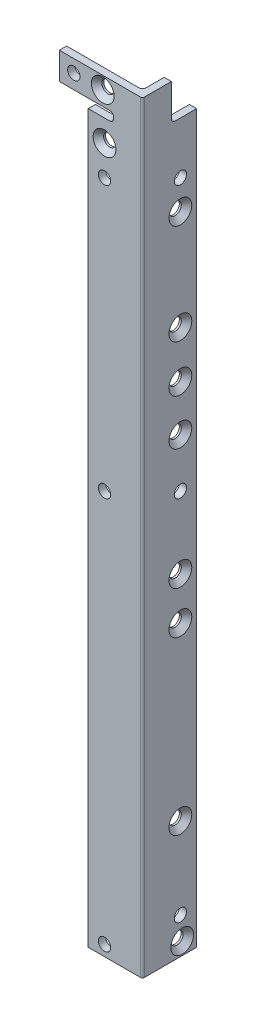
from build123d import *

# Parameters (mm, degrees)
BOSS_EXTRUDE1_DEPTH                             = 211
CSK_FOR_M3_FLAT_HEAD_MACHINE_SCREW1_D           = 3.4
CSK_FOR_M3_FLAT_HEAD_MACHINE_SCREW1_CSINK_D     = 6.3
CSK_FOR_M3_FLAT_HEAD_MACHINE_SCREW1_CSINK_ANGLE = 90
SKETCH5_W                                       = 7
SKETCH5_H                                       = 10
CUT_EXTRUDE1_DEPTH                              = 213.063669684
SKETCH6_W                                       = 7
SKETCH6_H                                       = 2.5
CUT_EXTRUDE2_DEPTH                              = 213.063669684
CSK_FOR_M3_FLAT_HEAD_MACHINE_SCREW2_D           = 3.4
CSK_FOR_M3_FLAT_HEAD_MACHINE_SCREW2_CSINK_D     = 6.3
CSK_FOR_M3_FLAT_HEAD_MACHINE_SCREW2_CSINK_ANGLE = 90
CSK_FOR_M3_FLAT_HEAD_MACHINE_SCREW3_D           = 3.4
CSK_FOR_M3_FLAT_HEAD_MACHINE_SCREW3_CSINK_D     = 6.3
CSK_FOR_M3_FLAT_HEAD_MACHINE_SCREW3_CSINK_ANGLE = 90
FILLET1_R                                       = 0.5
FILLET2_R                                       = 1
CUT_EXTRUDE3_START                              = -10
SKETCH13_R                                      = 1.7
CUT_EXTRUDE3_DEPTH                              = 10
CUT_EXTRUDE4_START                              = -10
SKETCH14_R                                      = 1.7
CUT_EXTRUDE4_DEPTH                              = 10
SKETCH16_W                                      = 2
SKETCH16_H                                      = 7.5
BOSS_EXTRUDE2_DEPTH                             = 8
SKETCH17_R                                      = 1.7
CUT_EXTRUDE5_DEPTH                              = 8


with BuildPart() as part:
    # Sketch1 → Boss-Extrude1 (new body)
    with BuildSketch(Plane(origin=(0, 0, 0), x_dir=(1, 0, 0), z_dir=(0, 1, 0))):
        Polygon((-15, 0), (0, 0), (0, 15), (-2, 15), (-2, 2), (-15, 2), align=None)
    extrude(amount=BOSS_EXTRUDE1_DEPTH)

    # CSK for M3 Flat Head Machine Screw1 (through all)
    with Locations(Plane(origin=(0, 0, 0), x_dir=(0, 0, -1), z_dir=(1, 0, 0))):
        with Locations((10.5, 178.5483), (10.5, 150.81169946), (10.5, 137.8117), (10.5, 125.120702), (10.5, 91.71900188), (10.5, 79.920702), (10.5, 32.510702)):
            CounterSinkHole(CSK_FOR_M3_FLAT_HEAD_MACHINE_SCREW1_D / 2, CSK_FOR_M3_FLAT_HEAD_MACHINE_SCREW1_CSINK_D / 2, counter_sink_angle=CSK_FOR_M3_FLAT_HEAD_MACHINE_SCREW1_CSINK_ANGLE)

    # Sketch5 → Cut-Extrude1 (cut, through all)
    with BuildSketch(Plane(origin=(0, 0, 0), x_dir=(0, 0, -1), z_dir=(1, 0, 0))):
        with Locations((11.5, 206)):
            Rectangle(SKETCH5_W, SKETCH5_H)
    extrude(amount=-CUT_EXTRUDE1_DEPTH, mode=Mode.SUBTRACT)

    # Sketch6 → Cut-Extrude2 (cut, through all)
    with BuildSketch(Plane.XY):
        with Locations((-11.5, 202.25)):
            Rectangle(SKETCH6_W, SKETCH6_H)
    extrude(amount=-CUT_EXTRUDE2_DEPTH, mode=Mode.SUBTRACT)

    # CSK for M3 Flat Head Machine Screw2 (through all)
    with Locations(Plane.XY):
        with Locations((-11, 207.5), (-10.5, 195)):
            CounterSinkHole(CSK_FOR_M3_FLAT_HEAD_MACHINE_SCREW2_D / 2, CSK_FOR_M3_FLAT_HEAD_MACHINE_SCREW2_CSINK_D / 2, counter_sink_angle=CSK_FOR_M3_FLAT_HEAD_MACHINE_SCREW2_CSINK_ANGLE)

    # CSK for M3 Flat Head Machine Screw3 (through all)
    with Locations(Plane(origin=(0, 0, 0), x_dir=(0, 0, -1), z_dir=(1, 0, 0))):
        with Locations((11, 3.5)):
            CounterSinkHole(CSK_FOR_M3_FLAT_HEAD_MACHINE_SCREW3_D / 2, CSK_FOR_M3_FLAT_HEAD_MACHINE_SCREW3_CSINK_D / 2, counter_sink_angle=CSK_FOR_M3_FLAT_HEAD_MACHINE_SCREW3_CSINK_ANGLE)

    # Fillet1
    fillet1_edges = [part.edges().sort_by_distance(p)[0] for p in [
        (0, 105.5, 0),
    ]]
    fillet(fillet1_edges, radius=FILLET1_R)

    # Fillet2
    fillet2_edges = [part.edges().sort_by_distance(p)[0] for p in [
        (-8, 203.5, -1),
        (-8, 201, -1),
        (-2, 105.5, -2),
        (-1, 201, -8),
    ]]
    fillet(fillet2_edges, radius=FILLET2_R)

    # Sketch13 → Cut-Extrude3 (cut)
    with BuildSketch(Plane(origin=(0, 0, 0), x_dir=(0, 0, -1), z_dir=(1, 0, 0)).offset(CUT_EXTRUDE3_START)):
        with Locations((10.5, 10)):
            Circle(SKETCH13_R)
        with Locations((10.5, 111.59)):
            Circle(SKETCH13_R)
        with Locations((10.5, 186.68)):
            Circle(SKETCH13_R)
        with Locations((10.5, 178.5483)):
            Circle(SKETCH13_R)
    extrude(amount=CUT_EXTRUDE3_DEPTH, mode=Mode.SUBTRACT)

    # Sketch14 → Cut-Extrude4 (cut)
    with BuildSketch(Plane.XY.offset(CUT_EXTRUDE4_START)):
        with Locations((-10.5, 195)):
            Circle(SKETCH14_R)
        with Locations((-10.5, 186.68)):
            Circle(SKETCH14_R)
        with Locations((-10.5, 111.59)):
            Circle(SKETCH14_R)
        with Locations((-10.5, 3)):
            Circle(SKETCH14_R)
    extrude(amount=CUT_EXTRUDE4_DEPTH, mode=Mode.SUBTRACT)

    # Sketch16 → Boss-Extrude2 (add)
    with BuildSketch(Plane.ZY.offset(15)):
        with Locations((-1, 207.25)):
            Rectangle(SKETCH16_W, SKETCH16_H)
    extrude(amount=BOSS_EXTRUDE2_DEPTH)

    # Sketch17 → Cut-Extrude5 (cut)
    with BuildSketch(Plane(origin=(0, 0, -2), x_dir=(-1, 0, 0), z_dir=(0, 0, -1))):
        with Locations((19, 207.5)):
            Circle(SKETCH17_R)
    extrude(amount=-CUT_EXTRUDE5_DEPTH, mode=Mode.SUBTRACT)


solid = part.part
